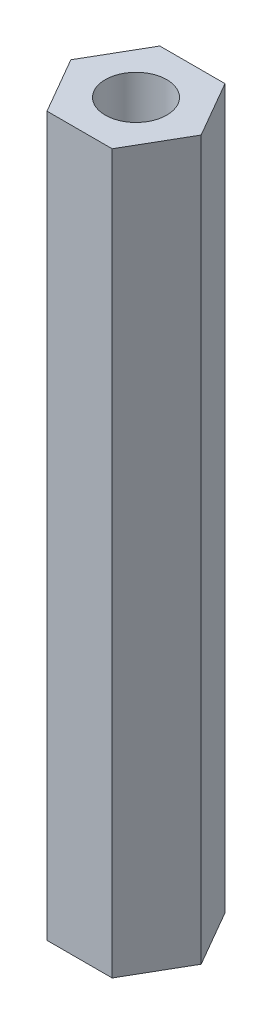
from build123d import *

# Parameters (mm, degrees)
SKETCH_1_R      = 1.5
EXTRUDE_1_DEPTH = 35


with BuildPart() as part:
    # 草图1 → 凸台-拉伸1 (new body)
    with BuildSketch(Plane(origin=(0, 0, 0), x_dir=(1, 0, 0), z_dir=(0, 1, 0))):
        Polygon((3.175426481, 0), (1.58771324, 2.75), (-1.58771324, 2.75), (-3.175426481, 0), (-1.58771324, -2.75), (1.58771324, -2.75), align=None)
        with Locations(Location((0, 0, 0), (0, 0, 270))):
            Circle(SKETCH_1_R, mode=Mode.SUBTRACT)
    extrude(amount=EXTRUDE_1_DEPTH)


solid = part.part
